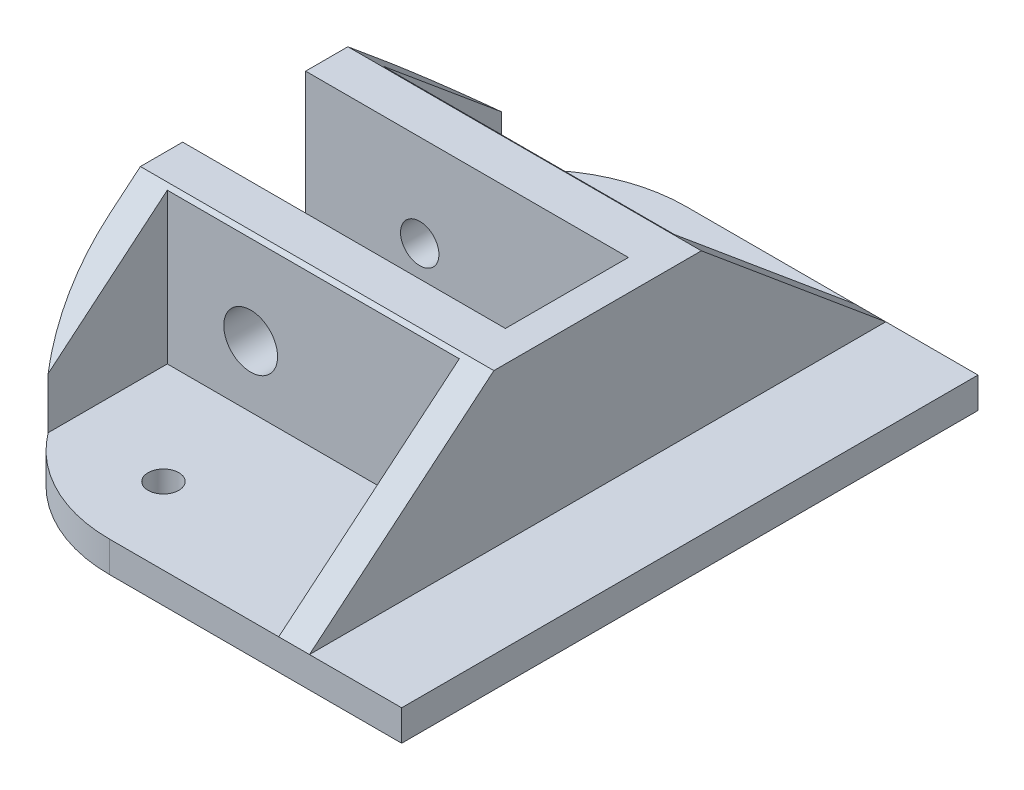
from build123d import *
from OCP.BRepFilletAPI import BRepFilletAPI_MakeChamfer

# Parameters (mm, degrees)
TOPSKETCH1_R                         = 1
TOPBOSS_EXTRUDE1_DEPTH               = 2
RAILCLAMPBOSS_EXTRUDE2_DEPTH         = 10
RAILSCREWSIDE1HOLECUT_EXTRUDE1_REACH = 42.596
RAILSCREWSIDE1HOLESKETCH3_R          = 1.75
RAILSCREWSIDE2HOLECUT_EXTRUDE2_REACH = 42.596
RAILSCREWSIDE2HOLESKETCH4_R          = 1.25
FILLET1_R                            = 10
CHAMFER2_SIZE                        = 10
CHAMFER2_SIZE2                       = 12


with BuildPart() as part:
    # TopSketch1 → TopBoss-Extrude1 (new body)
    with BuildSketch(Plane(origin=(0, 0, 0), x_dir=(1, 0, 0), z_dir=(0, 1, 0))):
        Polygon((0, 0), (29, 0), (29, 37.5), (0, 37.5), (0, 22.75), (21, 22.75), (21, 14.75), (0, 14.75), align=None)
        with Locations(Location((8.5, 32.5, 0), (0, 0, 270))):
            Circle(TOPSKETCH1_R, mode=Mode.SUBTRACT)
        with Locations(Location((8.5, 5, 0), (0, 0, 270))):
            Circle(TOPSKETCH1_R, mode=Mode.SUBTRACT)
    extrude(amount=TOPBOSS_EXTRUDE1_DEPTH)

    # RailClampSketch2 → RailClampBoss-Extrude2 (add)
    with BuildSketch(Plane(origin=(0, 2, 0), x_dir=(1, 0, 0), z_dir=(0, 1, 0))):
        Polygon((0, 37.5), (0, 22.75), (21, 22.75), (21, 14.75), (0, 14.75), (0, 0), (2, 0), (2, 11.75), (21, 11.75), (21, 0), (23, 0), (23, 37.5), (21, 37.5), (21, 25.75), (2, 25.75), (2, 37.5), align=None)
    extrude(amount=RAILCLAMPBOSS_EXTRUDE2_DEPTH)

    # RailScrewSide1HoleSketch3 → RailScrewSide1HoleCut-Extrude1 (cut, up to next)
    with BuildSketch(Plane.XY.offset(-11.75), mode=Mode.PRIVATE) as railscrewside1holecut_extrude1_sk1:
        with Locations((7.425, 6)):
            Circle(RAILSCREWSIDE1HOLESKETCH3_R)
    railscrewside1holecut_extrude1_tool1 = extrude(railscrewside1holecut_extrude1_sk1.sketch, amount=-RAILSCREWSIDE1HOLECUT_EXTRUDE1_REACH, mode=Mode.PRIVATE) & part.part
    add(railscrewside1holecut_extrude1_tool1.solids().sort_by_distance((7.425, 6, -11.75))[0], mode=Mode.SUBTRACT)

    # RailScrewSide2HoleSketch4 → RailScrewSide2HoleCut-Extrude2 (cut, up to next)
    with BuildSketch(Plane(origin=(0, 0, -25.75), x_dir=(-1, 0, 0), z_dir=(0, 0, -1)), mode=Mode.PRIVATE) as railscrewside2holecut_extrude2_sk1:
        with Locations((-7.425, 6)):
            Circle(RAILSCREWSIDE2HOLESKETCH4_R)
    railscrewside2holecut_extrude2_tool1 = extrude(railscrewside2holecut_extrude2_sk1.sketch, amount=-RAILSCREWSIDE2HOLECUT_EXTRUDE2_REACH, mode=Mode.PRIVATE) & part.part
    add(railscrewside2holecut_extrude2_tool1.solids().sort_by_distance((7.425, 6, -25.75))[0], mode=Mode.SUBTRACT)

    # Fillet1
    fillet1_edges = [part.edges().sort_by_distance(p)[0] for p in [
        (0, 6, 0),
        (0, 6, -37.5),
    ]]
    fillet(fillet1_edges, radius=FILLET1_R)

    # Chamfer2: one chamfer whose edges measure the first distance from different faces: ONE call of the kernel's chamfer builder (chamfer() names one face for all edges)
    chamfer2_edges_1 = [part.edges().sort_by_distance(p)[0] for p in [
        (22, 12, -37.5),
    ]]
    chamfer2_side_1 = [part.faces().sort_by_distance(p)[0] for p in [
        (15.5, 1.775277949, -37.5),
    ]]
    chamfer2_edges_2 = [part.edges().sort_by_distance(p)[0] for p in [
        (22, 12, 0),
    ]]
    chamfer2_side_2 = [part.faces().sort_by_distance(p)[0] for p in [
        (15.5, 1.775277949, 0),
    ]]
    chamfer2 = BRepFilletAPI_MakeChamfer(part.part.solid().wrapped)
    for e in chamfer2_edges_1:
        chamfer2.Add(CHAMFER2_SIZE, CHAMFER2_SIZE2, e.wrapped, chamfer2_side_1[0].wrapped)  # the first distance lies on this face
    for e in chamfer2_edges_2:
        chamfer2.Add(CHAMFER2_SIZE, CHAMFER2_SIZE2, e.wrapped, chamfer2_side_2[0].wrapped)  # the first distance lies on this face
    add(Compound.cast(chamfer2.Shape()), mode=Mode.REPLACE)


solid = part.part
